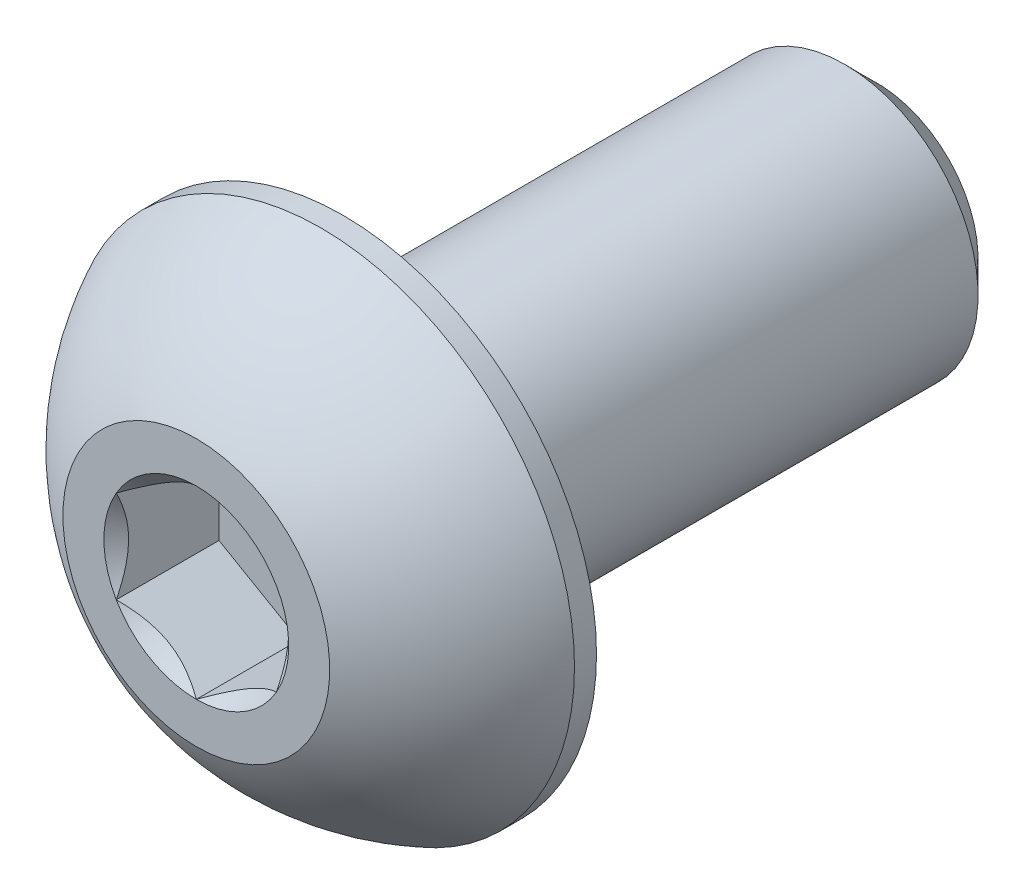
from build123d import *

# Parameters (mm, degrees)
CUT_EXTRUDE2_DEPTH = 1.925


with BuildPart() as part:
    # Sketch10 → Revolve3 (revolve)
    with BuildSketch(Plane(origin=(0, 0, 0), x_dir=(0, 0, -1), z_dir=(1, 0, 0))):
        Polygon((4.4, 2.5), (5, 1.9), (5, 0), (-5, 0), (-5, 2.5), align=None)
    revolve(axis=Axis((0, 0, 7.75), (0, 0, -1)))

    # Sketch7 → Revolve2 (revolve)
    with BuildSketch(Plane(origin=(0, 0, 0), x_dir=(0, 0, -1), z_dir=(1, 0, 0))):
        with BuildLine():
            Line((-5.4125, 4.75), (-5, 4.75))
            Line((-5, 4.75), (-5, 0))
            Line((-5, 0), (-7.75, 0))
            Line((-7.75, 0), (-7.75, 2.5))
            ThreePointArc((-7.75, 2.5), (-6.758124817, 3.808753282), (-5.4125, 4.75))
        make_face()
    revolve(axis=Axis((0, 0, 7.75), (0, 0, -1)))

    # Sketch5 → Cut-Extrude2 (cut)
    with BuildSketch(Plane.XY.offset(7.75)):
        Polygon((1.5, -0.866025404), (1.5, 0.866025404), (0, 1.732050808), (-1.5, 0.866025404), (-1.5, -0.866025404), (0, -1.732050808), align=None)
    extrude(amount=-CUT_EXTRUDE2_DEPTH, mode=Mode.SUBTRACT)

    # Cut-Extrude3 cone 1 section (through the dimple's axis) → Cut-Extrude3 (revolve, cut)
    with BuildSketch(Plane(origin=(0, 0, 7.75), x_dir=(0, -1, 0), z_dir=(1, 0, 0))):
        Polygon((0, 0), (1.732050808, 0), (0, 1.732050808), align=None)
    revolve(axis=Axis((0, 0, 7.75), (0, 0, -1)), mode=Mode.SUBTRACT)


solid = part.part
